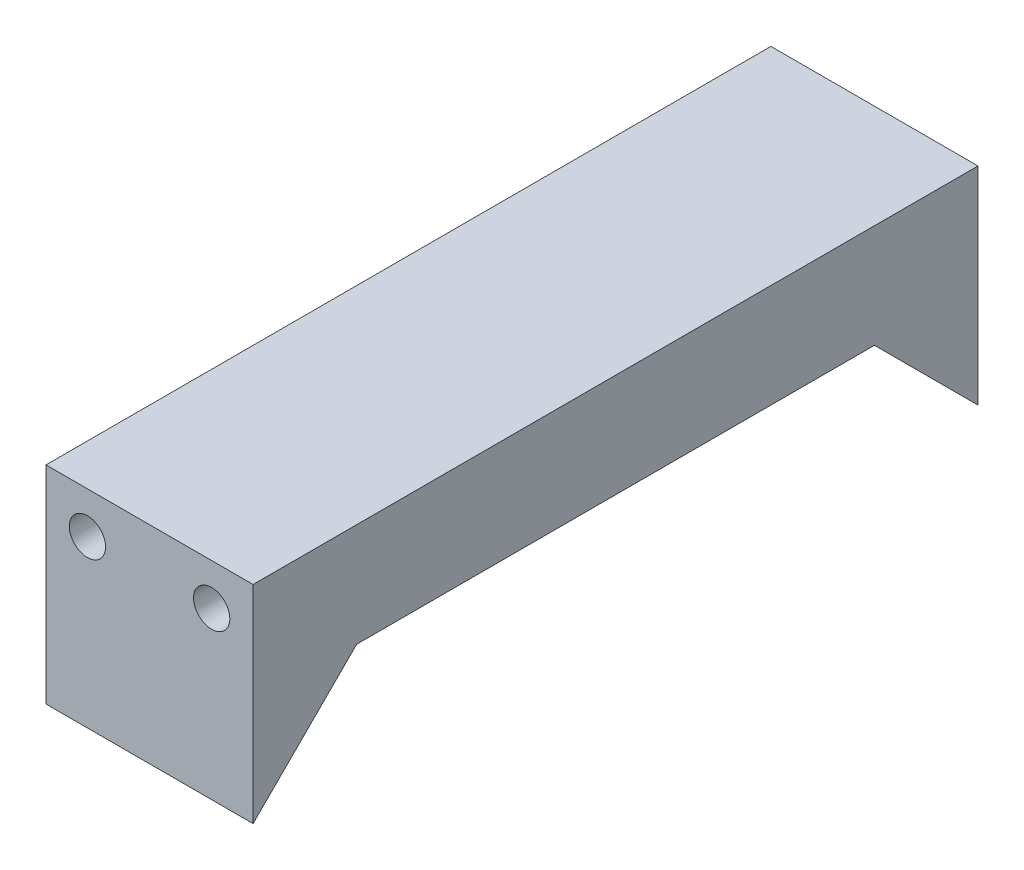
from build123d import *

# Parameters (mm, degrees)
BOSS_EXTRUDE1_DEPTH = 20
SKETCH2_R           = 1.75
CUT_EXTRUDE1_DEPTH  = 76.498344353


with BuildPart() as part:
    # Sketch1 → Boss-Extrude1 (new body)
    with BuildSketch(Plane(origin=(0, 0, 0), x_dir=(0, 0, -1), z_dir=(1, 0, 0))):
        Polygon((60, 10), (10, 10), (0, 0), (0, 20), (70, 20), (70, 0), align=None)
    extrude(amount=BOSS_EXTRUDE1_DEPTH)

    # Sketch2 → Cut-Extrude1 (cut, through all)
    with BuildSketch(Plane(origin=(0, 0, -70), x_dir=(-1, 0, 0), z_dir=(0, 0, -1))):
        with Locations((-4, 16)):
            Circle(SKETCH2_R)
        with Locations((-16, 16)):
            Circle(SKETCH2_R)
    extrude(amount=-CUT_EXTRUDE1_DEPTH, mode=Mode.SUBTRACT)


solid = part.part
